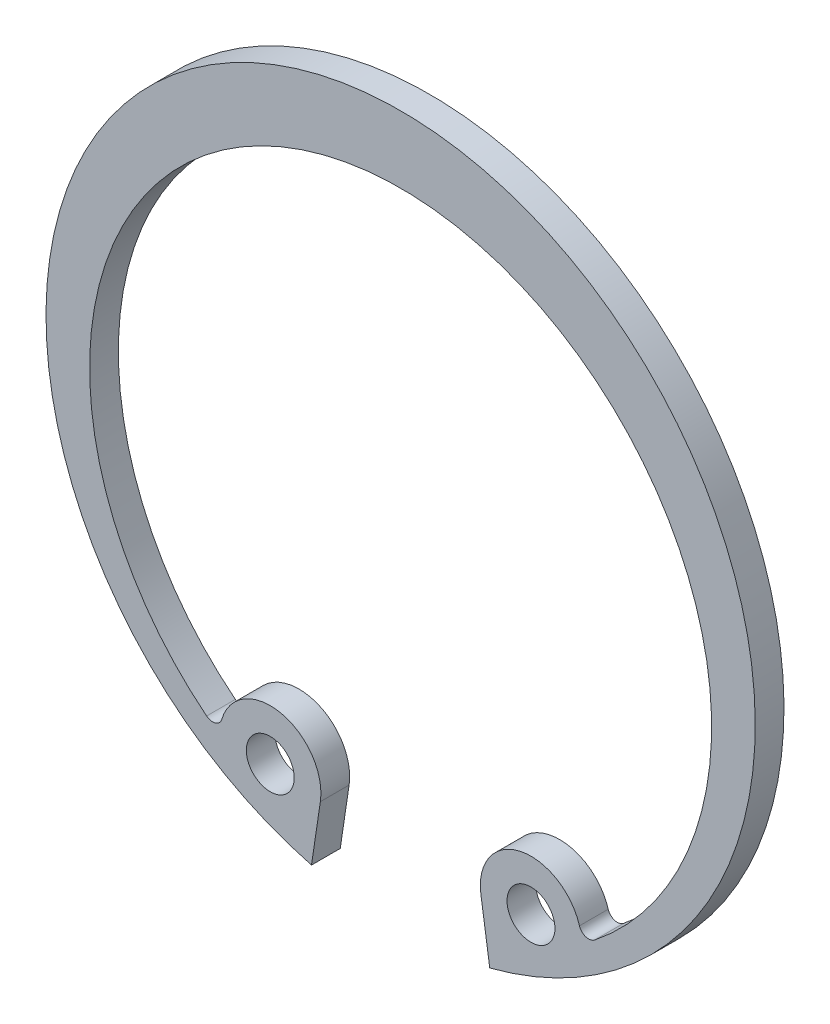
from build123d import *

# Parameters (mm, degrees)
SKETCH1_R           = 1.25
BOSS_EXTRUDE1_DEPTH = 1.5


with BuildPart() as part:
    # Sketch1 → Boss-Extrude1 (new body)
    with BuildSketch(Plane.XY):
        with BuildLine():
            Line((-4.187183708, -14.809298269), (-4.65, -17.906074388))
            ThreePointArc((-4.65, -17.906074388), (0, 18.5), (4.65, -17.906074388))
            Line((4.65, -17.906074388), (4.187183708, -14.809298269))
            ThreePointArc((4.187183708, -14.809298269), (6.223489354, -11.840647087), (9.330283518, -13.6592346))
            ThreePointArc((9.330283518, -13.6592346), (9.66008049, -13.992730113), (10.12106843, -13.906269607))
            ThreePointArc((10.12106843, -13.906269607), (0, 15), (-10.12106843, -13.906269607))
            ThreePointArc((-10.12106843, -13.906269607), (-9.66008049, -13.992730113), (-9.330283518, -13.6592346))
            ThreePointArc((-9.330283518, -13.6592346), (-6.223489354, -11.840647087), (-4.187183708, -14.809298269))
        make_face()
        with Locations((-6.8, -14.418810258)):
            Circle(SKETCH1_R, mode=Mode.SUBTRACT)
        with Locations((6.8, -14.418810258)):
            Circle(SKETCH1_R, mode=Mode.SUBTRACT)
    extrude(amount=BOSS_EXTRUDE1_DEPTH)


solid = part.part
